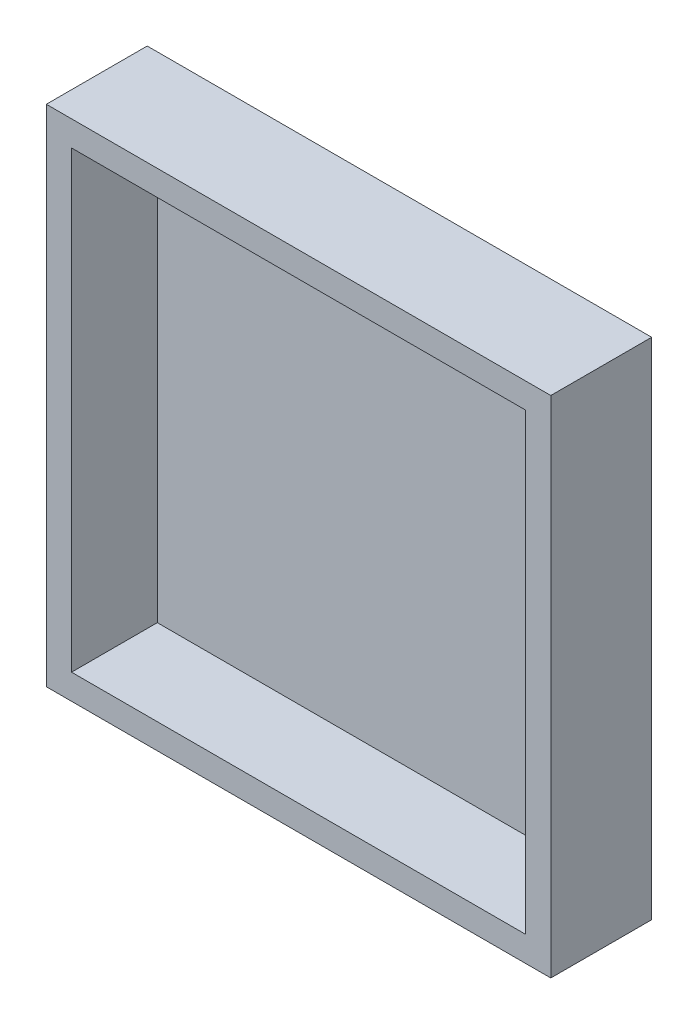
from build123d import *

# Parameters (mm, degrees)
SKETCH1_W           = 127
SKETCH1_H           = 127
BOSS_EXTRUDE1_DEPTH = 25.4
SKETCH2_W           = 114.3
SKETCH2_H           = 114.3
CUT_EXTRUDE1_DEPTH  = 21.59


with BuildPart() as part:
    # Sketch1 → Boss-Extrude1 (new body)
    with BuildSketch(Plane.XY):
        Rectangle(SKETCH1_W, SKETCH1_H)
    extrude(amount=BOSS_EXTRUDE1_DEPTH)

    # Sketch2 → Cut-Extrude1 (cut)
    with BuildSketch(Plane.XY.offset(25.4)):
        Rectangle(SKETCH2_W, SKETCH2_H)
    extrude(amount=-CUT_EXTRUDE1_DEPTH, mode=Mode.SUBTRACT)


solid = part.part
